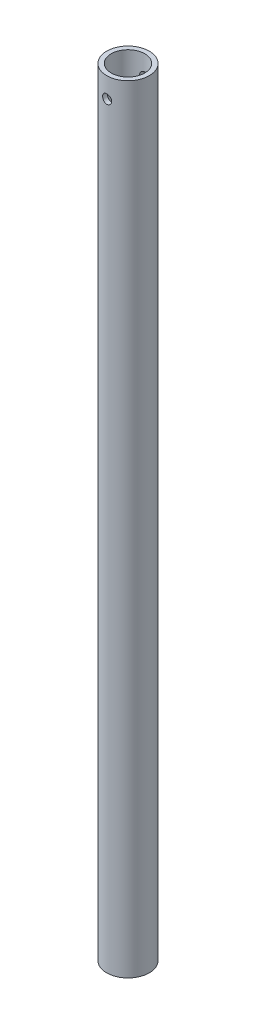
from build123d import *

# Parameters (mm, degrees)
SWEEP1_PROFILE_R        = 16.7005
SHELL1_T                = -3.556
F_1_4_CLEARANCE_HOLE4_D = 7.14248


with BuildPart() as part:
    # Sweep1: sweep along a path in Sketch2
    with BuildLine(Plane(origin=(0, 0, 0), x_dir=(0, 0, -1), z_dir=(1, 0, 0))) as sweep1_path:
        Line((0, 0), (0, 609.6))
    # Sweep1 profile (on start of the path) → Sweep1 (sweep)
    with BuildSketch(Plane.ZX):
        Circle(SWEEP1_PROFILE_R)
    sweep(path=sweep1_path.line)

    # Shell1
    shell1_openings = [part.faces().sort_by_distance(p)[0] for p in [
        (0, 609.6, 0),
        (0, 0, 0),
    ]]
    offset(amount=SHELL1_T, openings=shell1_openings, kind=Kind.INTERSECTION)

    # 1/4 Clearance Hole4 (through all)
    with Locations(Plane.XY.offset(16.7005)):
        with Locations((0, 593.725)):
            Hole(F_1_4_CLEARANCE_HOLE4_D / 2)


solid = part.part
